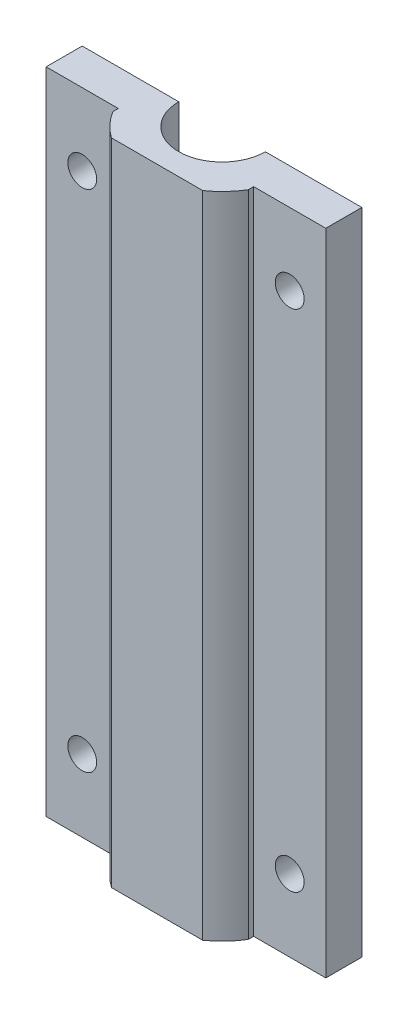
from build123d import *

# Parameters (mm, degrees)
ROTATION1_ANGLE                      = 180
SCHNITT_LINEAR_AUSTRAGEN2_DEPTH      = 92.33454987
SCHNITT_LINEAR_AUSTRAGEN2_DEPTH_BACK = 90
SCHNITT_LINEAR_AUSTRAGEN3_DEPTH      = 92.33454987
SCHNITT_LINEAR_AUSTRAGEN3_DEPTH_BACK = 90
SKIZZE8_W                            = 10
SKIZZE8_H                            = 5
AUFSATZ_LINEAR_AUSTRAGEN2_DEPTH      = 90
SKIZZE9_W                            = 10
SKIZZE9_H                            = 5
AUFSATZ_LINEAR_AUSTRAGEN3_DEPTH      = 90
SKIZZE14_R                           = 2
SCHNITT_LINEAR_AUSTRAGEN7_DEPTH      = 93.258379674
SKIZZE16_R                           = 1
SCHNITT_LINEAR_AUSTRAGEN8_DEPTH      = 93.717898057
SKIZZE18_R                           = 4
SCHNITT_LINEAR_AUSTRAGEN9_DEPTH      = 5
SKIZZE20_W                           = 21.700648505
SKIZZE20_H                           = 2
SCHNITT_LINEAR_AUSTRAGEN10_DEPTH     = 93.717898057


with BuildPart() as part:
    # Skizze3 → Rotation1 (revolve)
    with BuildSketch(Plane.XY):
        Polygon((0, 0), (-11, 0), (-11, 90), (-6, 90), (-6, 10), (0, 10), align=None)
    revolve(axis=Axis((0, 0, 0), (0, 1, 0)), revolution_arc=ROTATION1_ANGLE)

    # Skizze6 → Schnitt-Linear austragen2 (cut, two sides: drawn at the far end of the back side and taken through both)
    with BuildSketch(Plane(origin=(0, 90, 0), x_dir=(1, 0, 0), z_dir=(0, 1, 0)).offset(-SCHNITT_LINEAR_AUSTRAGEN2_DEPTH_BACK)):
        Polygon((-9.380624863, -62.0642209), (-9.380624863, -5.744900102), (-9.380624863, 0), (-9.380624863, 56.319320799), (-122.01926646, 56.319320799), (-122.01926646, -62.0642209), align=None)
    extrude(amount=SCHNITT_LINEAR_AUSTRAGEN2_DEPTH + SCHNITT_LINEAR_AUSTRAGEN2_DEPTH_BACK, mode=Mode.SUBTRACT)

    # Skizze7 → Schnitt-Linear austragen3 (cut, two sides: drawn at the far end of the back side and taken through both)
    with BuildSketch(Plane.XZ.offset(-SCHNITT_LINEAR_AUSTRAGEN3_DEPTH_BACK)):
        Polygon((9.380624863, 59.241313346), (9.380624863, 5.744900102), (9.380624863, 0), (9.380624863, -53.496413245), (116.373451353, -53.496413245), (116.373451353, 59.241313346), align=None)
    extrude(amount=SCHNITT_LINEAR_AUSTRAGEN3_DEPTH + SCHNITT_LINEAR_AUSTRAGEN3_DEPTH_BACK, mode=Mode.SUBTRACT)

    # Skizze8 → Aufsatz-Linear austragen2 (add)
    with BuildSketch(Plane(origin=(0, 90, 0), x_dir=(1, 0, 0), z_dir=(0, 1, 0))):
        with Locations((-14.380624863, -2.5)):
            Rectangle(SKIZZE8_W, SKIZZE8_H)
    extrude(amount=-AUFSATZ_LINEAR_AUSTRAGEN2_DEPTH)

    # Skizze9 → Aufsatz-Linear austragen3 (add)
    with BuildSketch(Plane(origin=(0, 90, 0), x_dir=(1, 0, 0), z_dir=(0, 1, 0))):
        with Locations((14.380624863, -2.5)):
            Rectangle(SKIZZE9_W, SKIZZE9_H)
    extrude(amount=-AUFSATZ_LINEAR_AUSTRAGEN3_DEPTH)

    # Skizze14 → Schnitt-Linear austragen7 (cut, through all)
    with BuildSketch(Plane.XY.offset(5)):
        with Locations((-14.380624863, 80)):
            Circle(SKIZZE14_R)
        with Locations((-14.380624863, 10)):
            Circle(SKIZZE14_R)
        with Locations((14.380624863, 10)):
            Circle(SKIZZE14_R)
        with Locations((14.380624863, 80)):
            Circle(SKIZZE14_R)
    extrude(amount=-SCHNITT_LINEAR_AUSTRAGEN7_DEPTH, mode=Mode.SUBTRACT)

    # Skizze16 → Schnitt-Linear austragen8 (cut, through all)
    with BuildSketch(Plane.XZ):
        Circle(SKIZZE16_R)
    extrude(amount=-SCHNITT_LINEAR_AUSTRAGEN8_DEPTH, mode=Mode.SUBTRACT)

    # Skizze18 → Schnitt-Linear austragen9 (cut)
    with BuildSketch(Plane.XZ):
        Circle(SKIZZE18_R)
    extrude(amount=-SCHNITT_LINEAR_AUSTRAGEN9_DEPTH, mode=Mode.SUBTRACT)

    # Skizze20 → Schnitt-Linear austragen10 (cut, through all)
    with BuildSketch(Plane(origin=(0, 90, 0), x_dir=(1, 0, 0), z_dir=(0, 1, 0))):
        with Locations((-0.450220923, -10)):
            Rectangle(SKIZZE20_W, SKIZZE20_H)
    extrude(amount=-SCHNITT_LINEAR_AUSTRAGEN10_DEPTH, mode=Mode.SUBTRACT)


solid = part.part
